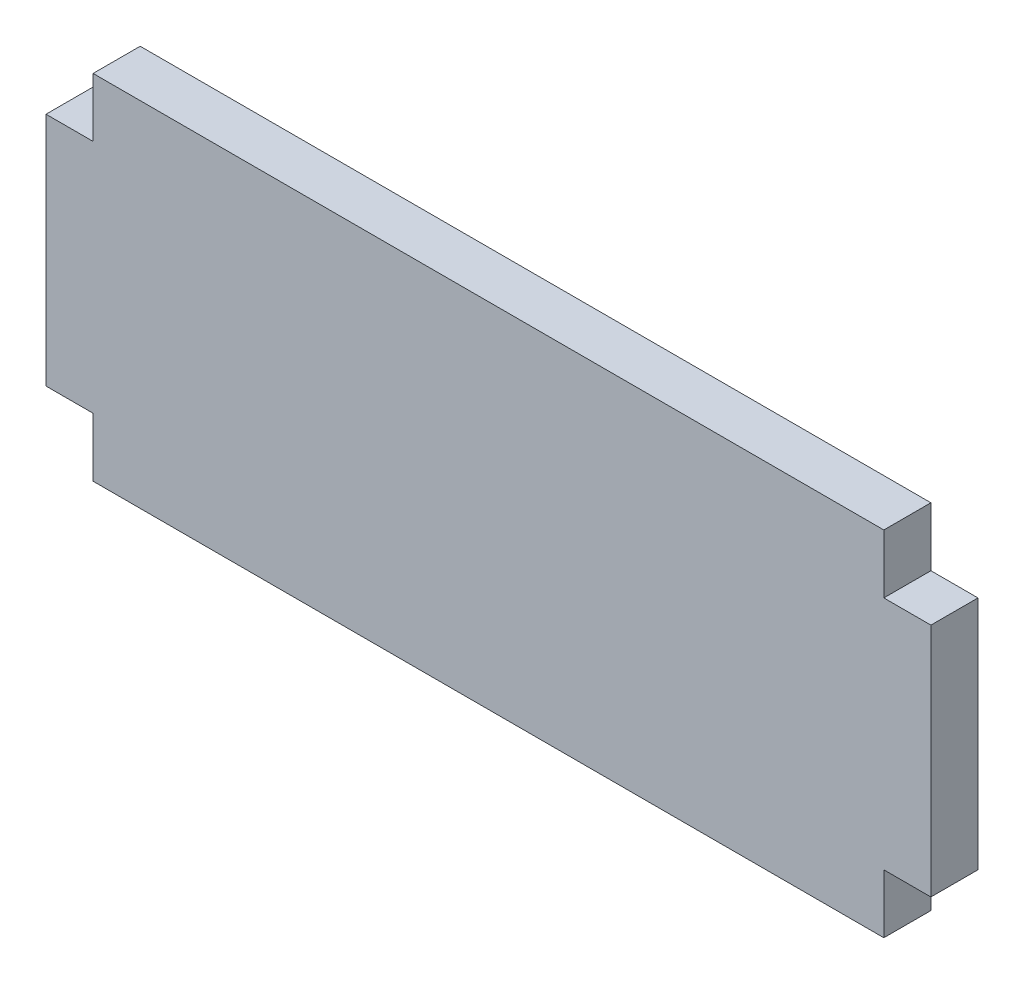
from build123d import *

# Parameters (mm, degrees)
BOSS_EXTRUDE1_DEPTH = 2.4


with BuildPart() as part:
    # Sketch1 → Boss-Extrude1 (new body)
    with BuildSketch(Plane.XY):
        Polygon((20.15, 9), (-20.15, 9), (-20.15, 6), (-22.55, 6), (-22.55, -6), (-20.15, -6), (-20.15, -9), (20.15, -9), (20.15, -6), (22.55, -6), (22.55, 6), (20.15, 6), align=None)
    extrude(amount=BOSS_EXTRUDE1_DEPTH)


solid = part.part
